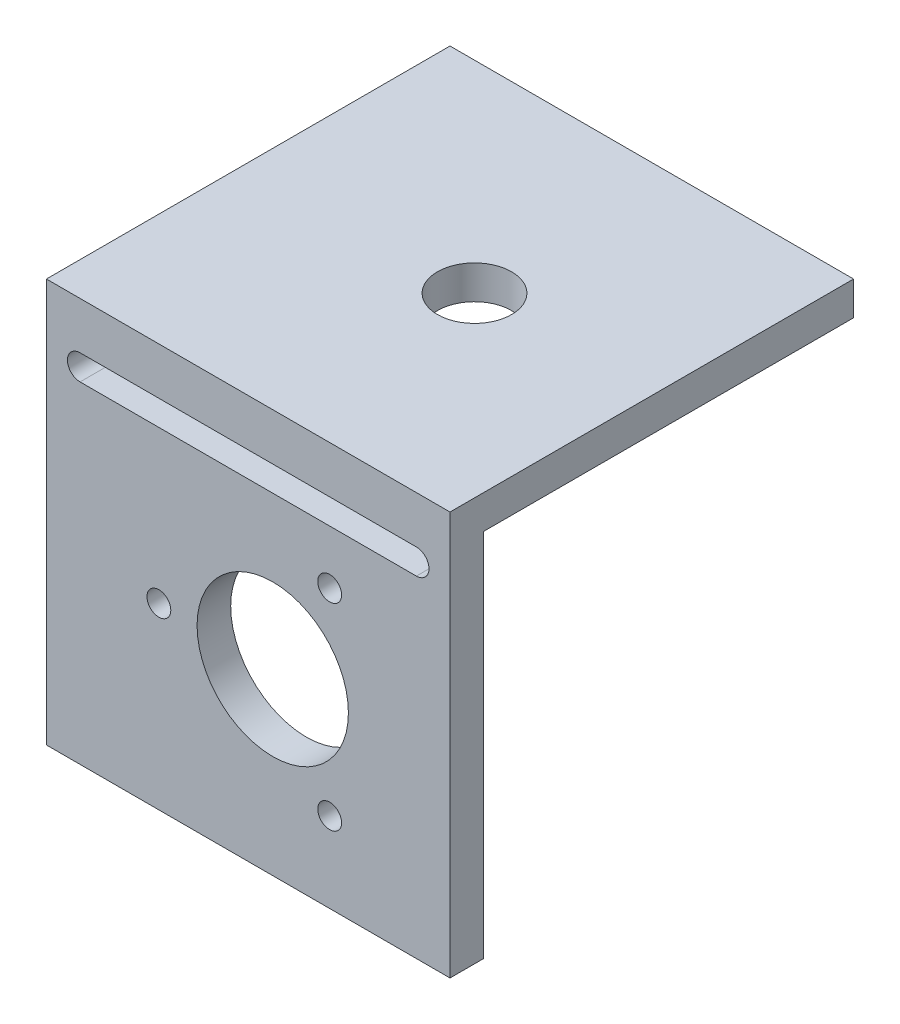
from build123d import *

# Parameters (mm, degrees)
BOSS_EXTRUDE1_DEPTH  = 76.2
SKETCH2_R            = 14.2875
CUT_EXTRUDE1_DEPTH   = 132.982271537
M4_CLEARANCE_HOLE1_D = 4.5
CUT_EXTRUDE2_REACH   = 130.421
SKETCH6_R            = 7
CUT_EXTRUDE3_DEPTH   = 129.420802443


with BuildPart() as part:
    # Sketch1 → Boss-Extrude1 (new body)
    with BuildSketch(Plane(origin=(0, 0, 0), x_dir=(0, 0, -1), z_dir=(1, 0, 0))):
        Polygon((-6.35, 76.2), (69.85, 76.2), (69.85, 69.85), (0, 69.85), (0, 0), (-6.35, 0), align=None)
    extrude(amount=BOSS_EXTRUDE1_DEPTH)

    # Sketch2 → Cut-Extrude1 (cut, through all)
    with BuildSketch(Plane.XY.offset(6.35)):
        with Locations((42.729606228, 33.762)):
            Circle(SKETCH2_R)
    extrude(amount=-CUT_EXTRUDE1_DEPTH, mode=Mode.SUBTRACT)

    # M4 Clearance Hole1 (through all)
    with Locations(Plane.XY.offset(6.35)):
        with Locations((53.479606228, 52.381546181), (21.229606228, 33.762), (53.479606228, 15.142453819)):
            Hole(M4_CLEARANCE_HOLE1_D / 2)

    # Sketch6 → Cut-Extrude2 (cut, up to next)
    with BuildSketch(Plane(origin=(0, 76.2, 0), x_dir=(1, 0, 0), z_dir=(0, 1, 0)), mode=Mode.PRIVATE) as cut_extrude2_sk1:
        with Locations(Location((42.729614414, 31.75, 0), (0, 0, 270))):
            Circle(SKETCH6_R)
    cut_extrude2_tool1 = extrude(cut_extrude2_sk1.sketch, amount=-CUT_EXTRUDE2_REACH, mode=Mode.PRIVATE) & part.part
    add(cut_extrude2_tool1.solids().sort_by_distance((42.729614, 76.2, -31.75))[0], mode=Mode.SUBTRACT)

    # Sketch7 → Cut-Extrude3 (cut, through all)
    with BuildSketch(Plane(origin=(0, 0, 0), x_dir=(-1, 0, 0), z_dir=(0, 0, -1))):
        with BuildLine():
            Line((-69.85, 67.31), (-6.35, 67.31))
            ThreePointArc((-6.35, 67.31), (-3.96875, 64.92875), (-6.35, 62.5475))
            Line((-6.35, 62.5475), (-69.85, 62.5475))
            ThreePointArc((-69.85, 62.5475), (-72.23125, 64.92875), (-69.85, 67.31))
        make_face()
    extrude(amount=-CUT_EXTRUDE3_DEPTH, mode=Mode.SUBTRACT)


solid = part.part
